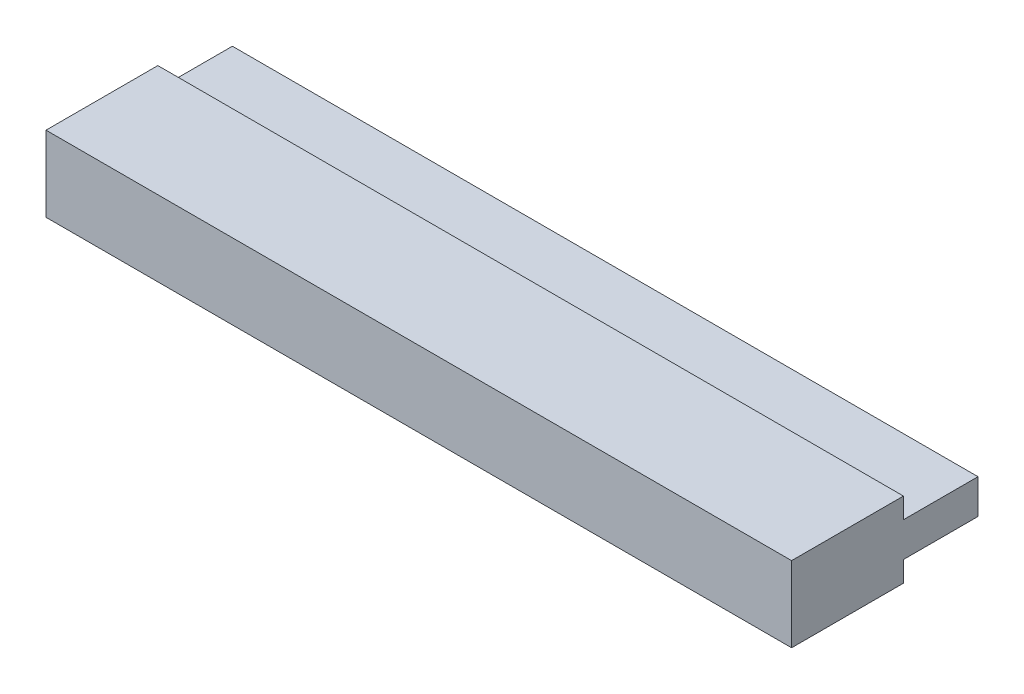
from build123d import *

# Parameters (mm, degrees)
SKETCH1_W           = 80
SKETCH1_H           = 8.1
BOSS_EXTRUDE1_DEPTH = 20
CUT_EXTRUDE1_DEPTH  = 85


with BuildPart() as part:
    # Sketch1 → Boss-Extrude1 (new body)
    with BuildSketch(Plane.XY):
        with Locations((40, 4.05)):
            Rectangle(SKETCH1_W, SKETCH1_H)
    extrude(amount=BOSS_EXTRUDE1_DEPTH)

    # Sketch2 → Cut-Extrude1 (cut)
    with BuildSketch(Plane.ZY):
        Polygon((0, 8.1), (8, 8.1), (8, 5.9), (1.006469224, 5.9), (0, 5.9), align=None)
        Polygon((0, 0), (8, 0), (8, 2.2), (1.006469224, 2.2), (0, 2.2), align=None)
    extrude(amount=-CUT_EXTRUDE1_DEPTH, mode=Mode.SUBTRACT)


solid = part.part
